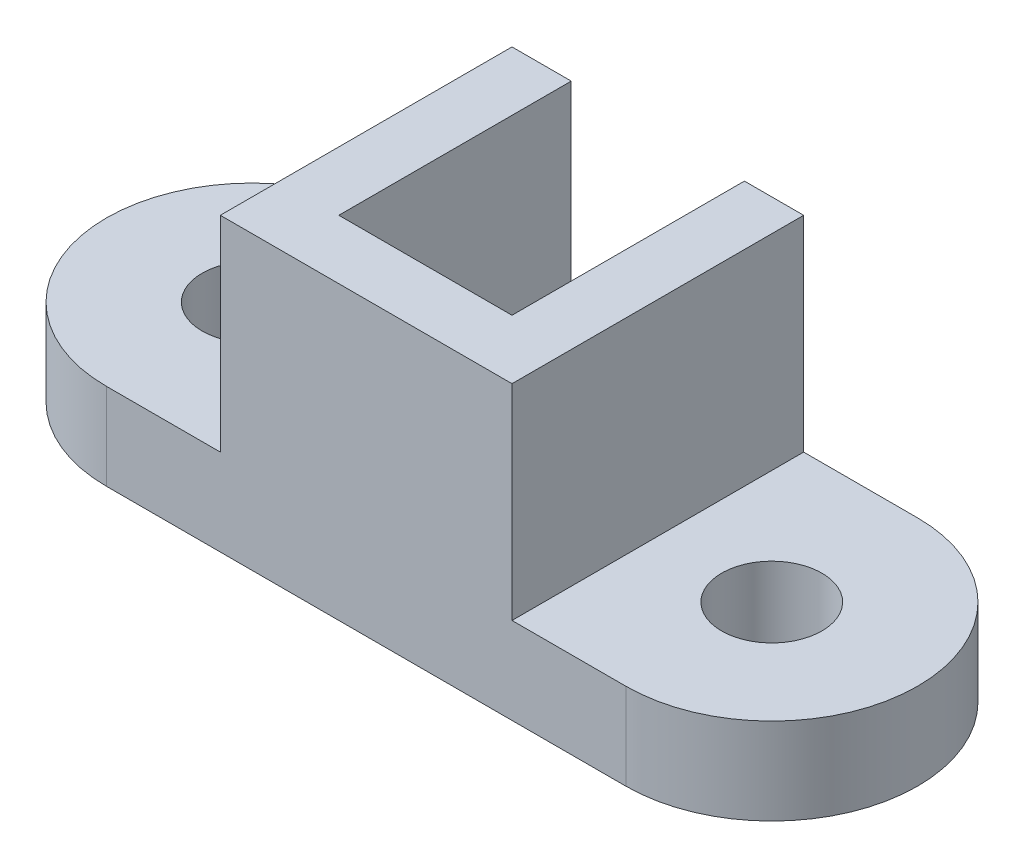
from build123d import *

# Parameters (mm, degrees)
BOSS_EXTRUDE1_DEPTH = 19
SKETCH2_W           = 64
SKETCH2_H           = 64
BOSS_EXTRUDE2_DEPTH = 45
CUT_EXTRUDE1_START  = -13
CUT_EXTRUDE1_DEPTH  = 38
SKETCH4_R           = 11
CUT_EXTRUDE2_DEPTH  = 157.092921044
SKETCH5_R           = 11
CUT_EXTRUDE3_DEPTH  = 157.092921044


with BuildPart() as part:
    # Sketch1 → Boss-Extrude1 (new body)
    with BuildSketch(Plane(origin=(0, 0, 0), x_dir=(1, 0, 0), z_dir=(0, 1, 0))):
        with BuildLine():
            Line((0, 32), (114, 32))
            ThreePointArc((114, 32), (146, 0), (114, -32))
            Line((114, -32), (0, -32))
            ThreePointArc((0, -32), (-32, 0), (0, 32))
        make_face()
    extrude(amount=BOSS_EXTRUDE1_DEPTH)

    # Sketch2 → Boss-Extrude2 (add)
    with BuildSketch(Plane(origin=(0, 19, 0), x_dir=(1, 0, 0), z_dir=(0, 1, 0))):
        with Locations((57, 0)):
            Rectangle(SKETCH2_W, SKETCH2_H)
    extrude(amount=BOSS_EXTRUDE2_DEPTH)

    # Sketch3 → Cut-Extrude1 (cut)
    with BuildSketch(Plane(origin=(89, 0, 0), x_dir=(0, 0, -1), z_dir=(1, 0, 0)).offset(CUT_EXTRUDE1_START)):
        Polygon((-19, 64), (32, 13), (32, 64), align=None)
    extrude(amount=-CUT_EXTRUDE1_DEPTH, mode=Mode.SUBTRACT)

    # Sketch4 → Cut-Extrude2 (cut, through all)
    with BuildSketch(Plane(origin=(0, 19, 0), x_dir=(1, 0, 0), z_dir=(0, 1, 0))):
        with Locations(Location((0, 0, 0), (0, 0, 270))):
            Circle(SKETCH4_R)
    extrude(amount=-CUT_EXTRUDE2_DEPTH, mode=Mode.SUBTRACT)

    # Sketch5 → Cut-Extrude3 (cut, through all)
    with BuildSketch(Plane(origin=(0, 19, 0), x_dir=(1, 0, 0), z_dir=(0, 1, 0))):
        with Locations(Location((114, 0, 0), (0, 0, 270))):
            Circle(SKETCH5_R)
    extrude(amount=-CUT_EXTRUDE3_DEPTH, mode=Mode.SUBTRACT)


solid = part.part
